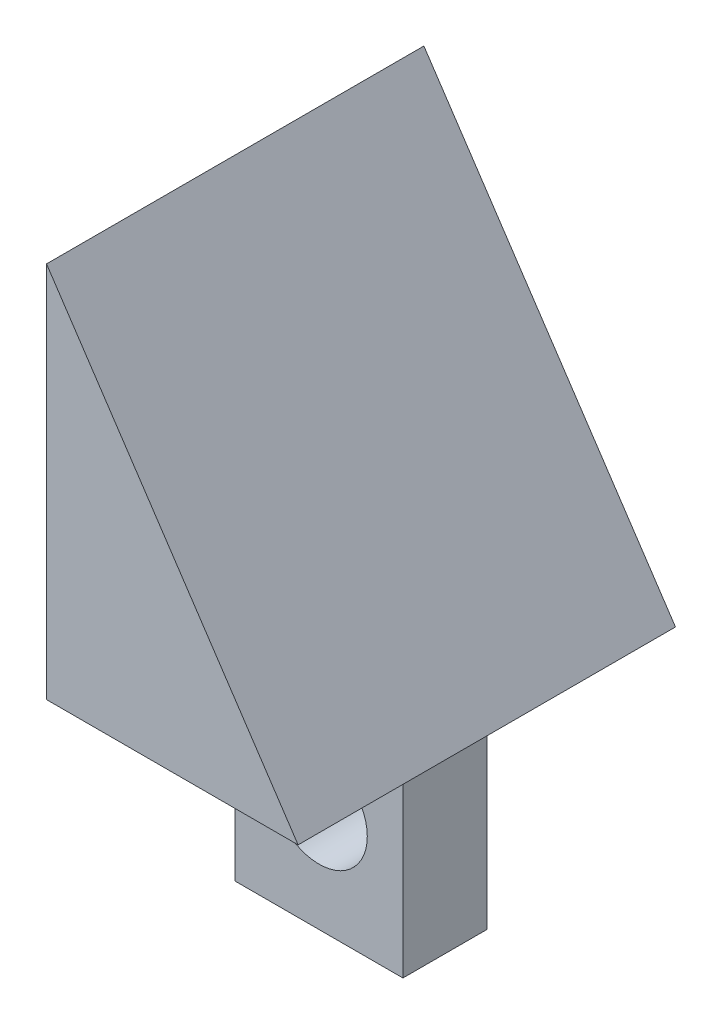
from build123d import *

# Parameters (mm, degrees)
BOSS_EXTRUDE1_DEPTH      = 18
BOSS_EXTRUDE2_DEPTH      = 2
BOSS_EXTRUDE2_DEPTH_BACK = 2
SKETCH2_W                = 8
SKETCH2_H                = 10
SKETCH2_R                = 2.3


with BuildPart() as part:
    # Sketch1 → Boss-Extrude1 (new body)
    with BuildSketch(Plane.XY):
        Polygon((0, 0), (0, 18), (12, 0), align=None)
    extrude(amount=BOSS_EXTRUDE1_DEPTH)

    # Sketch2 → Boss-Extrude2 (add, two sides: drawn at the far end of the back side and taken through both)
    with BuildSketch(Plane.XY.offset(9).offset(-BOSS_EXTRUDE2_DEPTH_BACK)):
        with Locations((6, -5)):
            Rectangle(SKETCH2_W, SKETCH2_H)
        with Locations((6, -5)):
            Circle(SKETCH2_R, mode=Mode.SUBTRACT)
    extrude(amount=BOSS_EXTRUDE2_DEPTH + BOSS_EXTRUDE2_DEPTH_BACK)


solid = part.part
